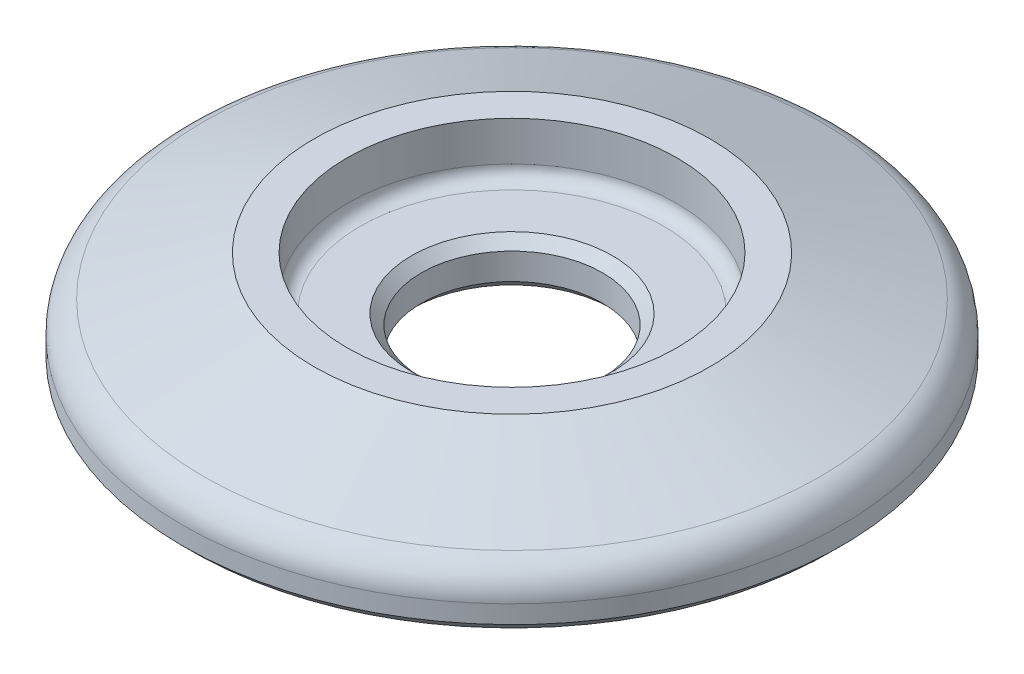
from build123d import *

# Parameters (mm, degrees)
FILLET2_R     = 1
FILLET3_R     = 0.4
CHAMFER1_SIZE = 0.3


with BuildPart() as part:
    # Sketch1 → Revolve1 (revolve)
    with BuildSketch(Plane.XY, mode=Mode.PRIVATE) as revolve1_sk:
        Polygon((2.75, 0), (2.75, 1.4), (5, 1.4), (5, 3), (6, 3), (10, 1.544119063), (10, 0), align=None)
    revolve(revolve1_sk.sketch.rotate(Axis((0, 0, 0), (0, 1, 0)), 90), axis=Axis((0, 0, 0), (0, 1, 0)))

    # Fillet2
    fillet2_edges = [part.edges().sort_by_distance(p)[0] for p in [
        (0, 1.544119063, 10),
    ]]
    fillet(fillet2_edges, radius=FILLET2_R)

    # Fillet3
    fillet3_edges = [part.edges().sort_by_distance(p)[0] for p in [
        (0, 1.4, 5),
    ]]
    fillet(fillet3_edges, radius=FILLET3_R)

    # Chamfer1
    chamfer1_edges = [part.edges().sort_by_distance(p)[0] for p in [
        (0, 0, 10),
        (0, 1.4, 2.75),
        (0, 0, 2.75),
    ]]
    chamfer(chamfer1_edges, length=CHAMFER1_SIZE)


solid = part.part
